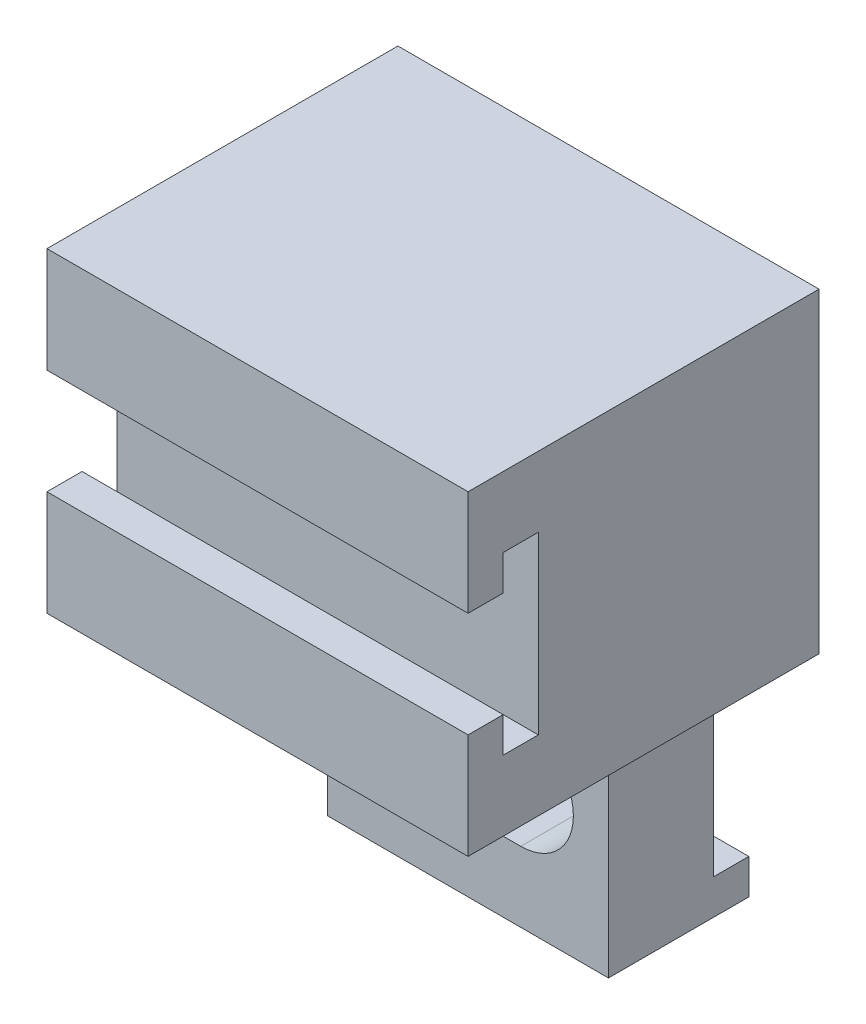
from build123d import *

# Parameters (mm, degrees)
BOSS_EXTRUDE1_DEPTH     = 60
BOSS_EXTRUDE2_DEPTH     = 40
CUT_EXTRUDE1_DEPTH      = 182.107702763
CUT_EXTRUDE1_DEPTH_BACK = 182.107702763


with BuildPart() as part:
    # Sketch1 → Boss-Extrude1 (new, symmetric)
    with BuildSketch(Plane.YZ):
        Polygon((70, 100), (70, 40), (70, 0), (160, 0), (160, 100), (130, 100), (130, 90), (140, 90), (140, 80), (90, 80), (90, 90), (100, 90), (100, 100), align=None)
    extrude(amount=BOSS_EXTRUDE1_DEPTH, both=True)

    # Sketch1<3> → Boss-Extrude2 (add, symmetric)
    with BuildSketch(Plane.YZ):
        Polygon((0, 40), (0, 0), (10, 0), (10, 10), (60, 10), (60, 0), (70, 0), (70, 40), align=None)
    extrude(amount=BOSS_EXTRUDE2_DEPTH, both=True)

    # Sketch2 → Cut-Extrude1 (cut, two sides: drawn at the far end of the back side and taken through both)
    with BuildSketch(Plane.XY.offset(40).offset(-CUT_EXTRUDE1_DEPTH_BACK)):
        with BuildLine():
            Line((-15, 50), (15, 50))
            ThreePointArc((15, 50), (30, 35), (15, 20))
            Line((15, 20), (-15, 20))
            ThreePointArc((-15, 20), (-30, 35), (-15, 50))
        make_face()
    extrude(amount=CUT_EXTRUDE1_DEPTH + CUT_EXTRUDE1_DEPTH_BACK, mode=Mode.SUBTRACT)


solid = part.part
